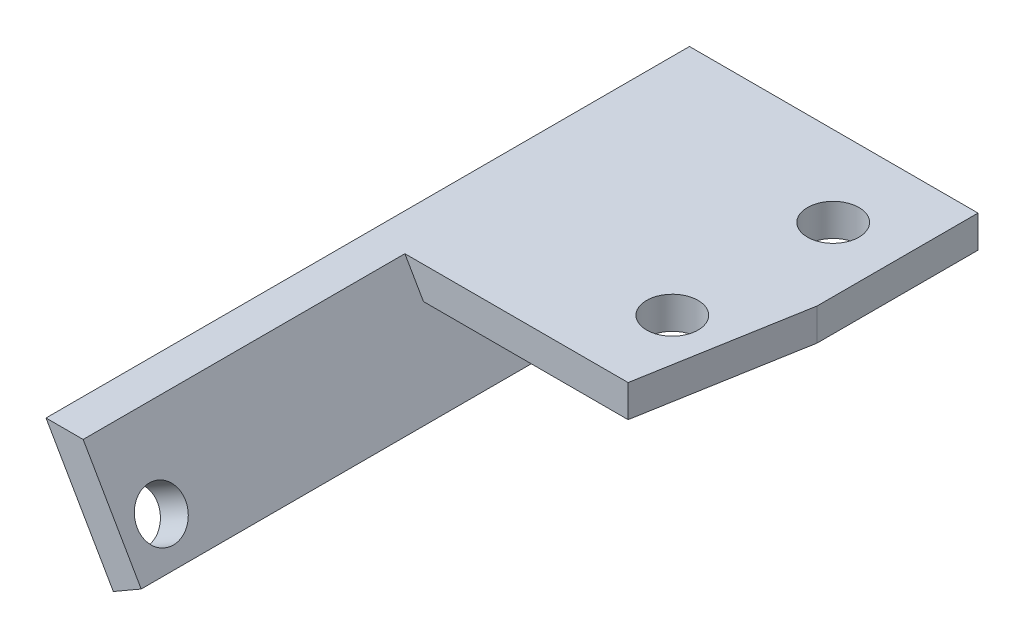
from build123d import *

# Parameters (mm, degrees)
BOSS_EXTRUDE1_DEPTH = 20
BOSS_EXTRUDE2_DEPTH = 20
CUT_EXTRUDE1_REACH  = 44.914
SKETCH3_R           = 1.5
SKETCH4_R           = 1.6
CUT_EXTRUDE2_DEPTH  = 43.62188405
CUT_EXTRUDE3_DEPTH  = 43.914158503


with BuildPart() as part:
    # Sketch1 → Boss-Extrude1 (new body)
    with BuildSketch(Plane.XY):
        Polygon((0, 0), (-4.185789452, 7.25), (13.75, 7.25), (13.75, 5.25), (-0.721687836, 5.25), (1.732050808, 1), align=None)
    extrude(amount=BOSS_EXTRUDE1_DEPTH)

    # Sketch2 → Boss-Extrude2 (add)
    with BuildSketch(Plane.XY.offset(20)):
        Polygon((-4.185789452, 7.25), (0, 0), (1.732050808, 1), (-1.876388375, 7.25), align=None)
    extrude(amount=BOSS_EXTRUDE2_DEPTH)

    # Sketch3 → Cut-Extrude1 (cut, up to next)
    with BuildSketch(Plane(origin=(0, 0, 0), x_dir=(0, 0, 1), z_dir=(-0.8660254037844363, -0.5000000000000042, 0)), mode=Mode.PRIVATE) as cut_extrude1_sk1:
        with Locations((2.5, 2.5)):
            Circle(SKETCH3_R)
    cut_extrude1_tool1 = extrude(cut_extrude1_sk1.sketch, amount=-CUT_EXTRUDE1_REACH, mode=Mode.PRIVATE) & part.part
    # Sketch3 → Cut-Extrude1 (cut, up to next)
    with BuildSketch(Plane(origin=(0, 0, 0), x_dir=(0, 0, 1), z_dir=(-0.8660254037844363, -0.5000000000000042, 0)), mode=Mode.PRIVATE) as cut_extrude1_sk2:
        with Locations((37.5, 2.5)):
            Circle(SKETCH3_R)
    cut_extrude1_tool2 = extrude(cut_extrude1_sk2.sketch, amount=-CUT_EXTRUDE1_REACH, mode=Mode.PRIVATE) & part.part
    add(cut_extrude1_tool1.solids().sort_by_distance((-1.25, 2.165064, 2.5))[0], mode=Mode.SUBTRACT)
    add(cut_extrude1_tool2.solids().sort_by_distance((-1.25, 2.165064, 37.5))[0], mode=Mode.SUBTRACT)

    # Sketch4 → Cut-Extrude2 (cut, through all)
    with BuildSketch(Plane.XZ.offset(-5.25)):
        with Locations((9.75, 15)):
            Circle(SKETCH4_R)
        with Locations((9.75, 5)):
            Circle(SKETCH4_R)
    extrude(amount=-CUT_EXTRUDE2_DEPTH, mode=Mode.SUBTRACT)

    # Sketch5 → Cut-Extrude3 (cut, through all)
    with BuildSketch(Plane(origin=(0, 7.25, 0), x_dir=(1, 0, 0), z_dir=(0, 1, 0))):
        Polygon((13.75, -20), (13.75, -10), (12, -20), align=None)
    extrude(amount=-CUT_EXTRUDE3_DEPTH, mode=Mode.SUBTRACT)


solid = part.part
